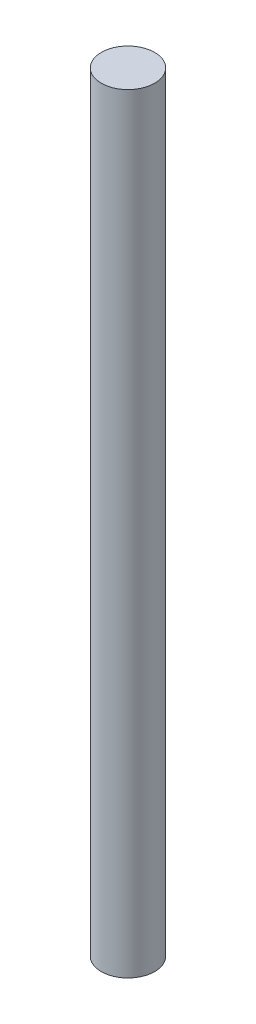
from build123d import *

# Parameters (mm, degrees)
SZKIC1_R                    = 2.5
DODANIE_WYCI_GNI_CIE1_DEPTH = 72.03


with BuildPart() as part:
    # Szkic1 → Dodanie-wyciągnięcie1 (new body)
    with BuildSketch(Plane(origin=(0, 0, 0), x_dir=(1, 0, 0), z_dir=(0, 1, 0))):
        with Locations(Location((0, 0, 0), (0, 0, 270))):
            Circle(SZKIC1_R)
    extrude(amount=DODANIE_WYCI_GNI_CIE1_DEPTH)


solid = part.part
